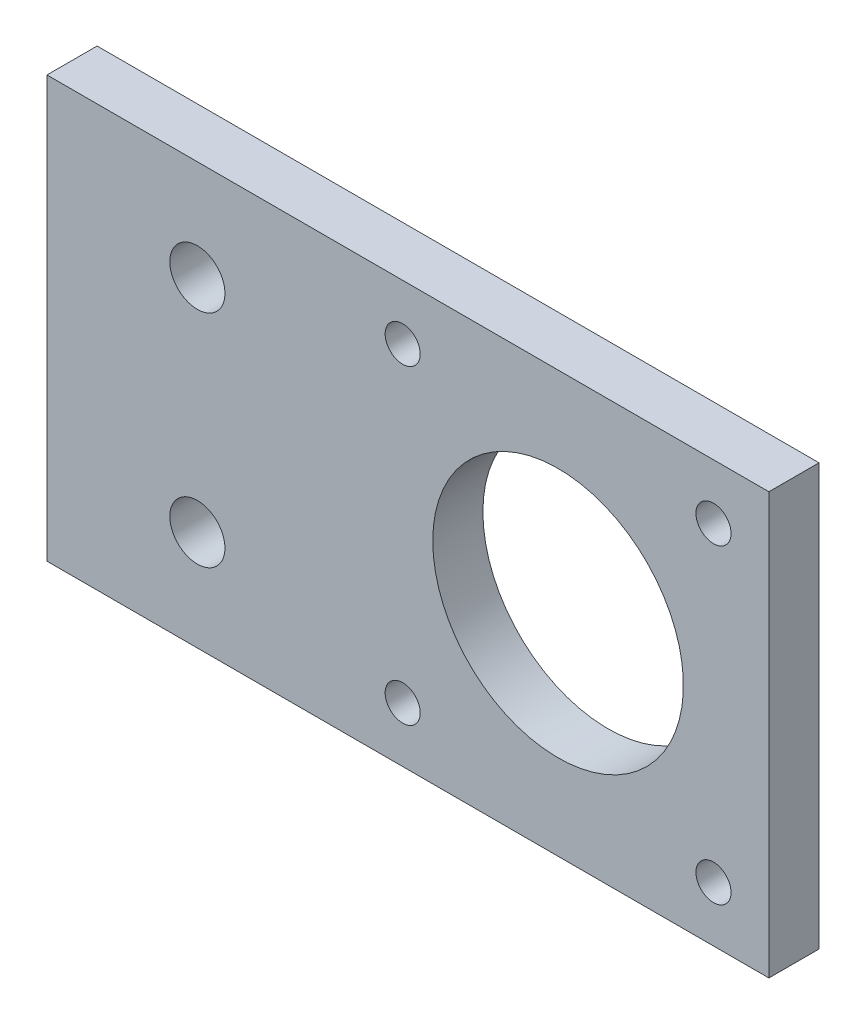
from build123d import *

# Parameters (mm, degrees)
SKETCH1_W           = 72
SKETCH1_H           = 42
BOSS_EXTRUDE1_DEPTH = 5
SKETCH2_R           = 1.75
CUT_EXTRUDE1_DEPTH  = 10
D_GAGEMENT_M51_D    = 5.5
SKETCH6_R           = 12.5
CUT_EXTRUDE2_DEPTH  = 42.976183724


with BuildPart() as part:
    # Sketch1 → Boss-Extrude1 (new body)
    with BuildSketch(Plane.XY):
        Rectangle(SKETCH1_W, SKETCH1_H)
    extrude(amount=BOSS_EXTRUDE1_DEPTH)

    # Sketch2 → Cut-Extrude1 (cut)
    with BuildSketch(Plane.XY.offset(5)):
        with Locations((30.475, 15.5)):
            Circle(SKETCH2_R)
        with Locations((30.475, -15.5)):
            Circle(SKETCH2_R)
        with Locations((-0.525, -15.5)):
            Circle(SKETCH2_R)
        with Locations((-0.525, 15.5)):
            Circle(SKETCH2_R)
    extrude(amount=-CUT_EXTRUDE1_DEPTH, mode=Mode.SUBTRACT)

    # Dégagement M51 (through all)
    with Locations(Plane(origin=(0, 0, 0), x_dir=(-1, 0, 0), z_dir=(0, 0, -1))):
        with Locations((21, 11), (21, -11)):
            Hole(D_GAGEMENT_M51_D / 2)

    # Sketch6 → Cut-Extrude2 (cut, through all)
    with BuildSketch(Plane(origin=(0, 0, 0), x_dir=(-1, 0, 0), z_dir=(0, 0, -1))):
        with Locations((-14.975, 0)):
            Circle(SKETCH6_R)
    extrude(amount=-CUT_EXTRUDE2_DEPTH, mode=Mode.SUBTRACT)


solid = part.part
